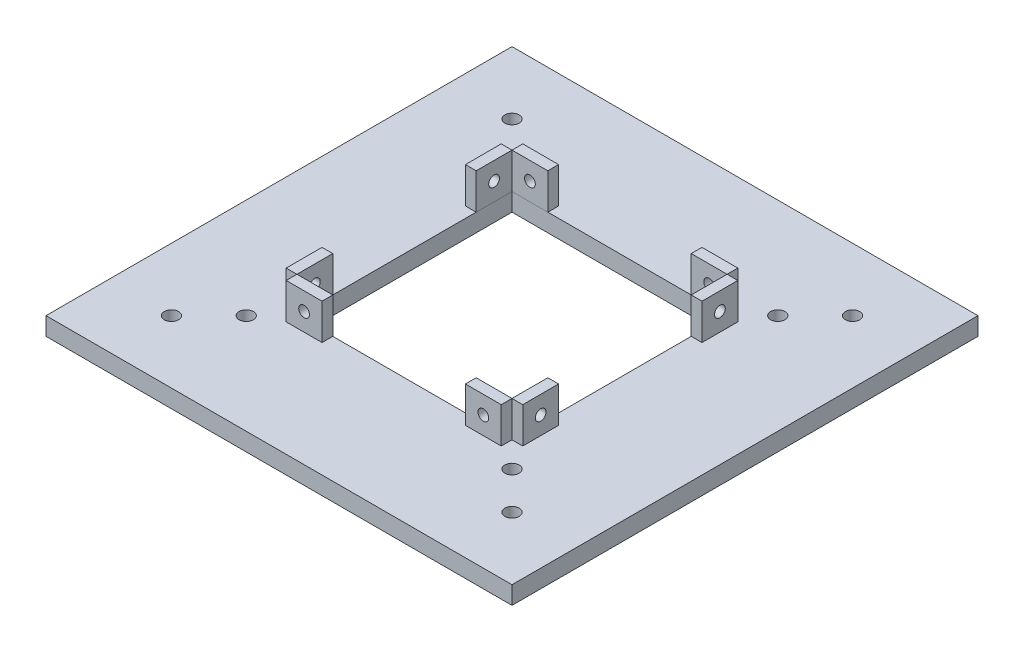
from build123d import *

# Parameters (mm, degrees)
SKETCH1_W              = 130
SKETCH1_H              = 130
SKETCH1_R              = 2
SKETCH1_W_2            = 60
SKETCH1_H_2            = 60
BOSS_EXTRUDE1_DEPTH    = 5
SKETCH2_W              = 3
SKETCH2_H              = 10
BOSS_EXTRUDE10_DEPTH   = 10
SKETCH2_W_2            = 10
SKETCH2_H_2            = 3
BOSS_EXTRUDE10_2_DEPTH = 10
BOSS_EXTRUDE10_3_DEPTH = 10
BOSS_EXTRUDE10_4_DEPTH = 10
BOSS_EXTRUDE10_5_DEPTH = 10
BOSS_EXTRUDE10_6_DEPTH = 10
BOSS_EXTRUDE10_7_DEPTH = 10
BOSS_EXTRUDE10_8_DEPTH = 10
SKETCH4_R              = 1.5
CUT_EXTRUDE1_DEPTH     = 82
SKETCH5_R              = 1.5
CUT_EXTRUDE2_DEPTH     = 82


with BuildPart() as part:
    # Sketch1 → Boss-Extrude1 (new body)
    with BuildSketch(Plane(origin=(0, 0, 0), x_dir=(1, 0, 0), z_dir=(0, 1, 0))):
        Rectangle(SKETCH1_W, SKETCH1_H)
        with Locations(Location((-47.5, 47.5, 0), (0, 0, 270))):
            Circle(SKETCH1_R, mode=Mode.SUBTRACT)
        with Locations(Location((-47.5, -47.5, 0), (0, 0, 270))):
            Circle(SKETCH1_R, mode=Mode.SUBTRACT)
        with Locations(Location((47.5, -47.5, 0), (0, 0, 270))):
            Circle(SKETCH1_R, mode=Mode.SUBTRACT)
        with Locations(Location((47.5, 47.5, 0), (0, 0, 270))):
            Circle(SKETCH1_R, mode=Mode.SUBTRACT)
        with Locations(Location((37.071067812, -37.071067812, 0), (0, 0, 270))):
            Circle(SKETCH1_R, mode=Mode.SUBTRACT)
        with Locations(Location((-37.071067812, -37.071067812, 0), (0, 0, 270))):
            Circle(SKETCH1_R, mode=Mode.SUBTRACT)
        with Locations(Location((-37.071067812, 37.071067812, 0), (0, 0, 270))):
            Circle(SKETCH1_R, mode=Mode.SUBTRACT)
        with Locations(Location((37.071067812, 37.071067812, 0), (0, 0, 270))):
            Circle(SKETCH1_R, mode=Mode.SUBTRACT)
        Rectangle(SKETCH1_W_2, SKETCH1_H_2, mode=Mode.SUBTRACT)
    extrude(amount=BOSS_EXTRUDE1_DEPTH)


with BuildPart() as body_2:
    # Sketch2 → Boss-Extrude10 (new body)
    with BuildSketch(Plane(origin=(0, 5, 0), x_dir=(1, 0, 0), z_dir=(0, 1, 0))):
        with Locations((-31.5, 25)):
            Rectangle(SKETCH2_W, SKETCH2_H)
    extrude(amount=BOSS_EXTRUDE10_DEPTH)


with BuildPart() as body_3:
    # Sketch2 → Boss-Extrude10 2 (new body)
    with BuildSketch(Plane(origin=(0, 5, 0), x_dir=(1, 0, 0), z_dir=(0, 1, 0))):
        with Locations((-25, 31.5)):
            Rectangle(SKETCH2_W_2, SKETCH2_H_2)
    extrude(amount=BOSS_EXTRUDE10_2_DEPTH)


with BuildPart() as body_4:
    # Sketch2 → Boss-Extrude10 3 (new body)
    with BuildSketch(Plane(origin=(0, 5, 0), x_dir=(1, 0, 0), z_dir=(0, 1, 0))):
        with Locations((25, 31.5)):
            Rectangle(SKETCH2_W_2, SKETCH2_H_2)
    extrude(amount=BOSS_EXTRUDE10_3_DEPTH)


with BuildPart() as body_5:
    # Sketch2 → Boss-Extrude10 4 (new body)
    with BuildSketch(Plane(origin=(0, 5, 0), x_dir=(1, 0, 0), z_dir=(0, 1, 0))):
        with Locations((25, -31.5)):
            Rectangle(SKETCH2_W_2, SKETCH2_H_2)
    extrude(amount=BOSS_EXTRUDE10_4_DEPTH)


with BuildPart() as body_6:
    # Sketch2 → Boss-Extrude10 5 (new body)
    with BuildSketch(Plane(origin=(0, 5, 0), x_dir=(1, 0, 0), z_dir=(0, 1, 0))):
        with Locations((31.5, 25)):
            Rectangle(SKETCH2_W, SKETCH2_H)
    extrude(amount=BOSS_EXTRUDE10_5_DEPTH)


with BuildPart() as body_7:
    # Sketch2 → Boss-Extrude10 6 (new body)
    with BuildSketch(Plane(origin=(0, 5, 0), x_dir=(1, 0, 0), z_dir=(0, 1, 0))):
        with Locations((-25, -31.5)):
            Rectangle(SKETCH2_W_2, SKETCH2_H_2)
    extrude(amount=BOSS_EXTRUDE10_6_DEPTH)


with BuildPart() as body_8:
    # Sketch2 → Boss-Extrude10 7 (new body)
    with BuildSketch(Plane(origin=(0, 5, 0), x_dir=(1, 0, 0), z_dir=(0, 1, 0))):
        with Locations((-31.5, -25)):
            Rectangle(SKETCH2_W, SKETCH2_H)
    extrude(amount=BOSS_EXTRUDE10_7_DEPTH)


with BuildPart() as body_9:
    # Sketch2 → Boss-Extrude10 8 (new body)
    with BuildSketch(Plane(origin=(0, 5, 0), x_dir=(1, 0, 0), z_dir=(0, 1, 0))):
        with Locations((31.5, -25)):
            Rectangle(SKETCH2_W, SKETCH2_H)
    extrude(amount=BOSS_EXTRUDE10_8_DEPTH)


with BuildPart() as cut_extrude1_tool:
    # Sketch4 → Cut-Extrude1 (new body)
    with BuildSketch(Plane.ZY.offset(33)):
        with Locations((-25, 10)):
            Circle(SKETCH4_R)
        with Locations((25, 10)):
            Circle(SKETCH4_R)
    extrude(amount=-CUT_EXTRUDE1_DEPTH)


with BuildPart() as body_2_1:
    add(body_2.part)

    # Cut-Extrude1: cut by cut_extrude1_tool
    add(cut_extrude1_tool.part, mode=Mode.SUBTRACT)


with BuildPart() as body_6_1:
    add(body_6.part)

    # Cut-Extrude1: cut by cut_extrude1_tool
    add(cut_extrude1_tool.part, mode=Mode.SUBTRACT)


with BuildPart() as body_8_1:
    add(body_8.part)

    # Cut-Extrude1: cut by cut_extrude1_tool
    add(cut_extrude1_tool.part, mode=Mode.SUBTRACT)


with BuildPart() as body_9_1:
    add(body_9.part)

    # Cut-Extrude1: cut by cut_extrude1_tool
    add(cut_extrude1_tool.part, mode=Mode.SUBTRACT)


with BuildPart() as cut_extrude2_tool:
    # Sketch5 → Cut-Extrude2 (new body)
    with BuildSketch(Plane(origin=(0, 0, -33), x_dir=(-1, 0, 0), z_dir=(0, 0, -1))):
        with Locations(Location((-25, 10, 0), (0, 0, 180))):
            Circle(SKETCH5_R)
        with Locations((25, 10)):
            Circle(SKETCH5_R)
    extrude(amount=-CUT_EXTRUDE2_DEPTH)


with BuildPart() as body_3_1:
    add(body_3.part)

    # Cut-Extrude2: cut by cut_extrude2_tool
    add(cut_extrude2_tool.part, mode=Mode.SUBTRACT)


with BuildPart() as body_4_1:
    add(body_4.part)

    # Cut-Extrude2: cut by cut_extrude2_tool
    add(cut_extrude2_tool.part, mode=Mode.SUBTRACT)


with BuildPart() as body_5_1:
    add(body_5.part)

    # Cut-Extrude2: cut by cut_extrude2_tool
    add(cut_extrude2_tool.part, mode=Mode.SUBTRACT)


with BuildPart() as body_7_1:
    add(body_7.part)

    # Cut-Extrude2: cut by cut_extrude2_tool
    add(cut_extrude2_tool.part, mode=Mode.SUBTRACT)


solid = Compound([part.part, body_2_1.part, body_6_1.part, body_8_1.part, body_9_1.part, body_3_1.part, body_4_1.part, body_5_1.part, body_7_1.part])
